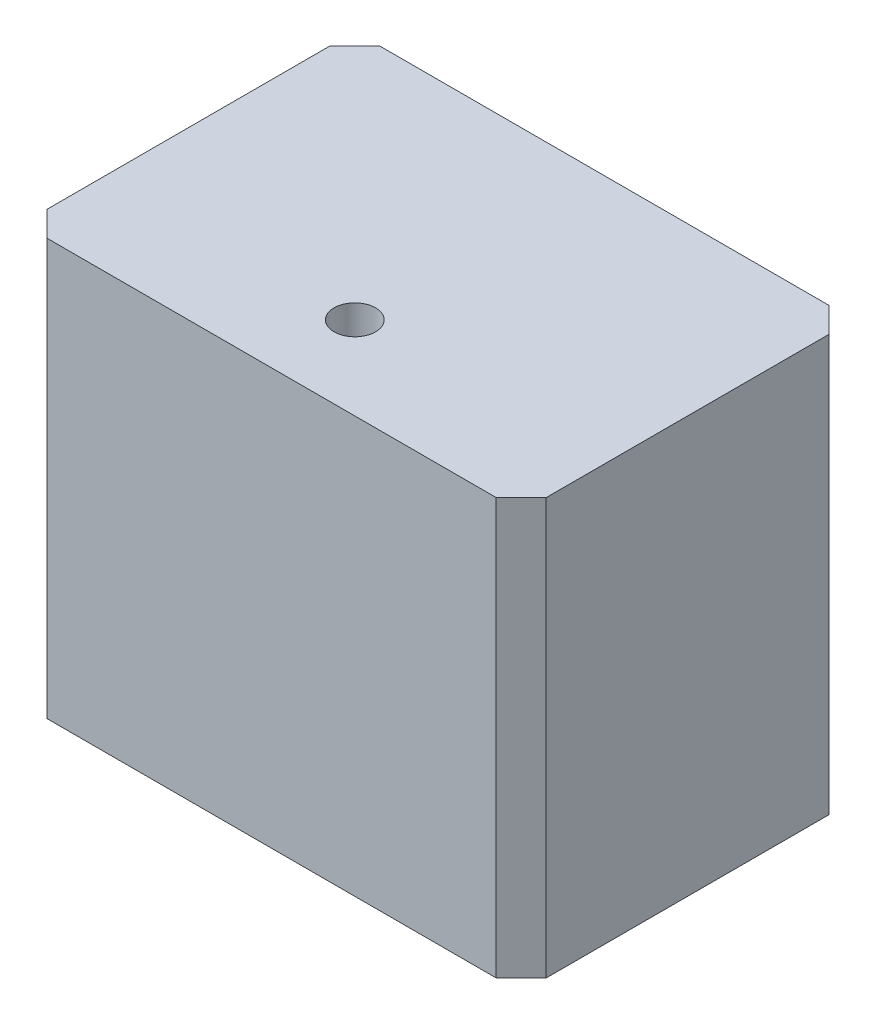
from build123d import *

# Parameters (mm, degrees)
SKETCH_1_W          = 30
SKETCH_1_H          = 20
EXTRUDE_1_DEPTH     = 25
SKETCH_2_R          = 1.25
CUT_EXTRUDE_1_DEPTH = 31.822070015
CHAMFER_1_SIZE      = 1.5


with BuildPart() as part:
    # 草图1 → 凸台-拉伸1 (new body)
    with BuildSketch(Plane(origin=(0, 0, 0), x_dir=(1, 0, 0), z_dir=(0, 1, 0))):
        Rectangle(SKETCH_1_W, SKETCH_1_H)
    extrude(amount=EXTRUDE_1_DEPTH)

    # 草图2 → 切除-拉伸1 (cut, through all)
    with BuildSketch(Plane(origin=(0, 25, 0), x_dir=(1, 0, 0), z_dir=(0, 1, 0))):
        with Locations(Location((0, -5, 0), (0, 0, 270))):
            Circle(SKETCH_2_R)
    extrude(amount=-CUT_EXTRUDE_1_DEPTH, mode=Mode.SUBTRACT)

    # 倒角1
    chamfer_1_edges = [part.edges().sort_by_distance(p)[0] for p in [
        (-15, 12.5, -10),
        (15, 12.5, -10),
        (15, 12.5, 10),
        (-15, 12.5, 10),
    ]]
    chamfer(chamfer_1_edges, length=CHAMFER_1_SIZE)


solid = part.part
